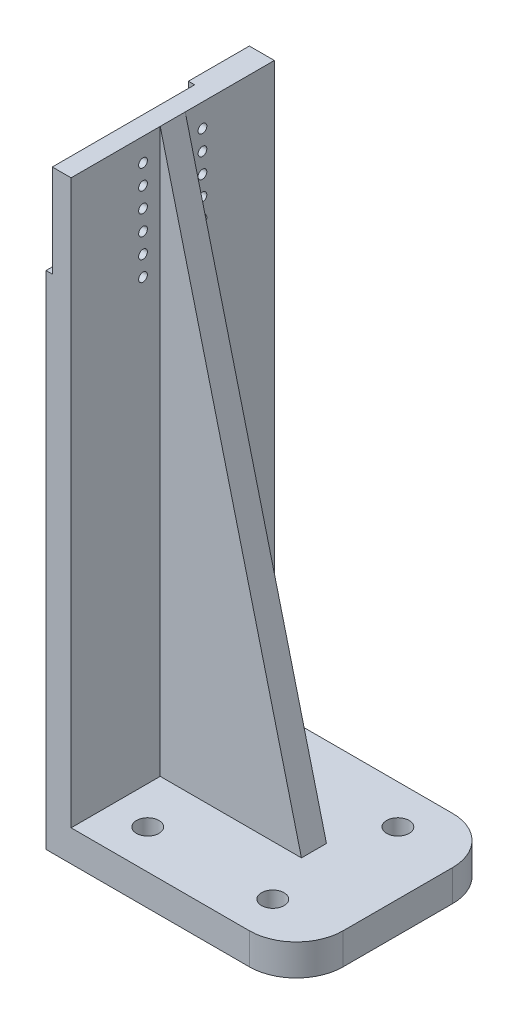
from build123d import *

# Parameters (mm, degrees)
AUFSATZ_LINEAR_AUSTRAGEN1_DEPTH = 32.5
AUFSATZ_LINEAR_AUSTRAGEN2_DEPTH = 4
SKIZZE4_W                       = 26
SKIZZE4_H                       = 42
SCHNITT_LINEAR_AUSTRAGEN1_DEPTH = 2
SKIZZE5_R                       = 1.4
SCHNITT_LINEAR_AUSTRAGEN2_DEPTH = 10
SKIZZE6_W                       = 34.028268395
SKIZZE6_H                       = 30
SCHNITT_LINEAR_AUSTRAGEN3_DEPTH = 2
SKIZZE7_R                       = 3.6
SCHNITT_LINEAR_AUSTRAGEN4_DEPTH = 10
VERRUNDUNG1_R                   = 15


with BuildPart() as part:
    # Skizze1 → Aufsatz-Linear austragen1 (new, symmetric)
    with BuildSketch(Plane.XY):
        Polygon((-39.374028295, 163.828996283), (-39.374028295, -26.171003717), (40.625971705, -26.171003717), (40.625971705, -16.171003717), (-31.374028295, -16.171003717), (-31.374028295, 163.828996283), align=None)
    extrude(amount=AUFSATZ_LINEAR_AUSTRAGEN1_DEPTH, both=True)

    # Skizze2 → Aufsatz-Linear austragen2 (add, symmetric)
    with BuildSketch(Plane.XY):
        Polygon((-31.374028295, 163.828996283), (13.784951867, -16.171003717), (-31.374028295, -16.171003717), align=None)
    extrude(amount=AUFSATZ_LINEAR_AUSTRAGEN2_DEPTH, both=True)

    # Skizze4 → Schnitt-Linear austragen1 (cut)
    with BuildSketch(Plane.ZY.offset(39.374028295)):
        with Locations((0, 142.828996283)):
            Rectangle(SKIZZE4_W, SKIZZE4_H)
    extrude(amount=-SCHNITT_LINEAR_AUSTRAGEN1_DEPTH, mode=Mode.SUBTRACT)

    # Skizze5 → Schnitt-Linear austragen2 (cut)
    with BuildSketch(Plane.ZY.offset(37.374028295)):
        with Locations(Location((-9.5, 124.828996283, 0), (0, 0, 270))):
            Circle(SKIZZE5_R)
        with Locations(Location((9.5, 124.828996283, 0), (0, 0, 270))):
            Circle(SKIZZE5_R)
        with Locations(Location((-9.5, 131.158996283, 0), (0, 0, 270))):
            Circle(SKIZZE5_R)
        with Locations(Location((9.5, 131.158996283, 0), (0, 0, 270))):
            Circle(SKIZZE5_R)
        with Locations(Location((-9.5, 137.488996283, 0), (0, 0, 270))):
            Circle(SKIZZE5_R)
        with Locations(Location((9.5, 137.488996283, 0), (0, 0, 270))):
            Circle(SKIZZE5_R)
        with Locations(Location((-9.5, 143.818996283, 0), (0, 0, 270))):
            Circle(SKIZZE5_R)
        with Locations(Location((9.5, 143.818996283, 0), (0, 0, 270))):
            Circle(SKIZZE5_R)
        with Locations(Location((-9.5, 150.148996283, 0), (0, 0, 270))):
            Circle(SKIZZE5_R)
        with Locations(Location((9.5, 150.148996283, 0), (0, 0, 270))):
            Circle(SKIZZE5_R)
        with Locations(Location((-9.5, 156.478996283, 0), (0, 0, 270))):
            Circle(SKIZZE5_R)
        with Locations(Location((9.5, 156.478996283, 0), (0, 0, 270))):
            Circle(SKIZZE5_R)
    extrude(amount=-SCHNITT_LINEAR_AUSTRAGEN2_DEPTH, mode=Mode.SUBTRACT)

    # Skizze6 → Schnitt-Linear austragen3 (cut)
    with BuildSketch(Plane.ZY.offset(39.374028295)):
        with Locations((17.014134198, 149.158996283)):
            Rectangle(SKIZZE6_W, SKIZZE6_H)
    extrude(amount=-SCHNITT_LINEAR_AUSTRAGEN3_DEPTH, mode=Mode.SUBTRACT)

    # Skizze7 → Schnitt-Linear austragen4 (cut)
    with BuildSketch(Plane(origin=(0, -16.171003717, 0), x_dir=(1, 0, 0), z_dir=(0, 1, 0))):
        with Locations(Location((20.625971705, 20, 0), (0, 0, 180))):
            Circle(SKIZZE7_R)
        with Locations(Location((20.625971705, -20, 0), (0, 0, 180))):
            Circle(SKIZZE7_R)
        with Locations(Location((-19.374028295, 20, 0), (0, 0, 180))):
            Circle(SKIZZE7_R)
        with Locations(Location((-19.374028295, -20, 0), (0, 0, 180))):
            Circle(SKIZZE7_R)
    extrude(amount=-SCHNITT_LINEAR_AUSTRAGEN4_DEPTH, mode=Mode.SUBTRACT)

    # Verrundung1
    verrundung1_edges = [part.edges().sort_by_distance(p)[0] for p in [
        (40.625971705, -21.171003717, 32.5),
        (40.625971705, -21.171003717, -32.5),
    ]]
    fillet(verrundung1_edges, radius=VERRUNDUNG1_R)


solid = part.part
